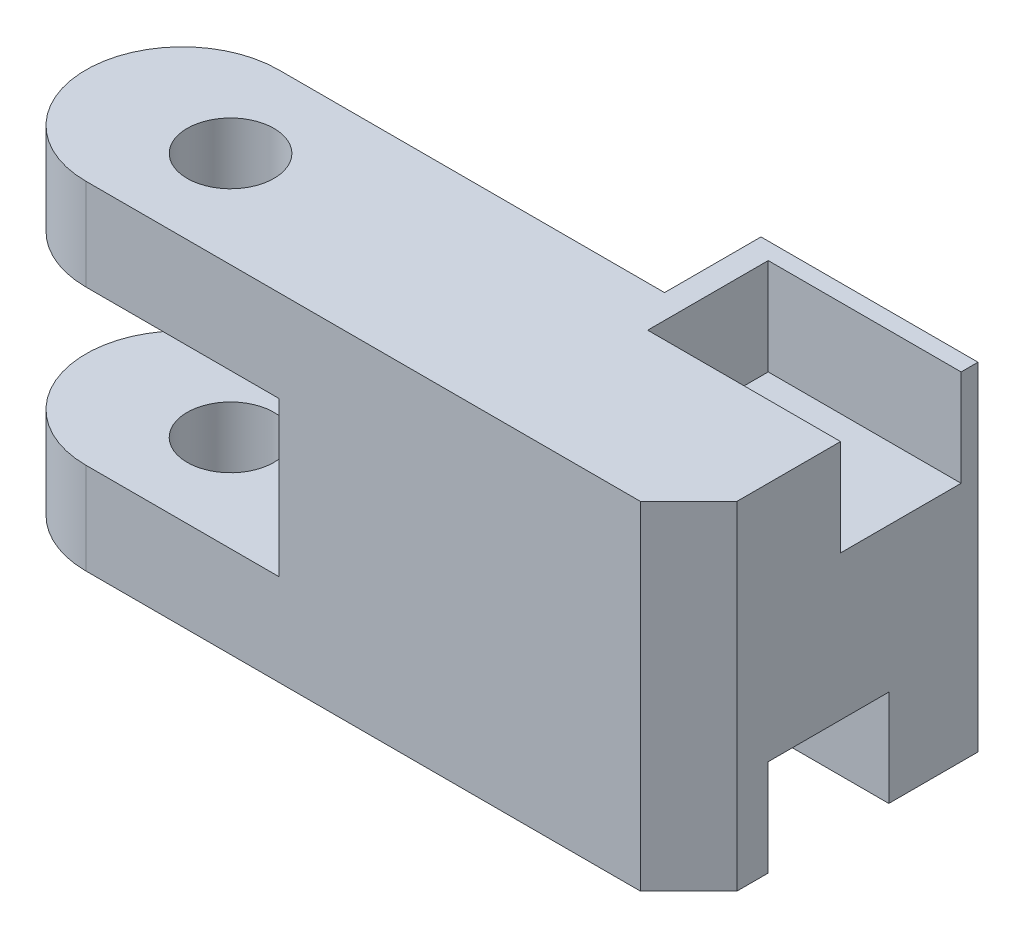
from build123d import *

# Parameters (mm, degrees)
SKETCH1_R           = 0.9
BOSS_EXTRUDE1_DEPTH = 7
CUT_EXTRUDE1_REACH  = 16.739
SKETCH2_W           = 6
SKETCH2_H           = 3.2
SKETCH3_W           = 2.5
SKETCH3_H           = 2
CUT_EXTRUDE2_DEPTH  = 4
CHAMFER1_SIZE       = 1


with BuildPart() as part:
    # Sketch1 → Boss-Extrude1 (new body)
    with BuildSketch(Plane(origin=(0, 0, 0), x_dir=(1, 0, 0), z_dir=(0, 1, 0))):
        with BuildLine():
            Line((-1, 2), (7, 2))
            Line((7, 2), (7, 4))
            Line((7, 4), (11.5, 4))
            Line((11.5, 4), (11.5, 2))
            Line((11.5, 2), (11.5, -2))
            Line((11.5, -2), (-1, -2))
            ThreePointArc((-1, -2), (-3, 0), (-1, 2))
        make_face()
        with Locations(Location((0, 0, 0), (0, 0, 270))):
            Circle(SKETCH1_R, mode=Mode.SUBTRACT)
    extrude(amount=BOSS_EXTRUDE1_DEPTH)

    # Sketch2 → Cut-Extrude1 (cut, up to next)
    with BuildSketch(Plane.XY.offset(2), mode=Mode.PRIVATE) as cut_extrude1_sk1:
        with Locations((0, 3.5)):
            Rectangle(SKETCH2_W, SKETCH2_H)
    cut_extrude1_tool1 = extrude(cut_extrude1_sk1.sketch, amount=-CUT_EXTRUDE1_REACH, mode=Mode.PRIVATE) & part.part
    add(cut_extrude1_tool1.solids().sort_by_distance((0, 3.5, 2))[0], mode=Mode.SUBTRACT)

    # Sketch3 → Cut-Extrude2 (cut)
    with BuildSketch(Plane(origin=(11.5, 0, 0), x_dir=(0, 0, -1), z_dir=(1, 0, 0))):
        with Locations((2.4, 6)):
            Rectangle(SKETCH3_W, SKETCH3_H)
        with Locations((0.9, 1)):
            Rectangle(SKETCH3_W, SKETCH3_H)
    extrude(amount=-CUT_EXTRUDE2_DEPTH, mode=Mode.SUBTRACT)

    # Chamfer1
    chamfer1_edges = [part.edges().sort_by_distance(p)[0] for p in [
        (11.5, 3.5, 2),
    ]]
    chamfer(chamfer1_edges, length=CHAMFER1_SIZE)


solid = part.part
